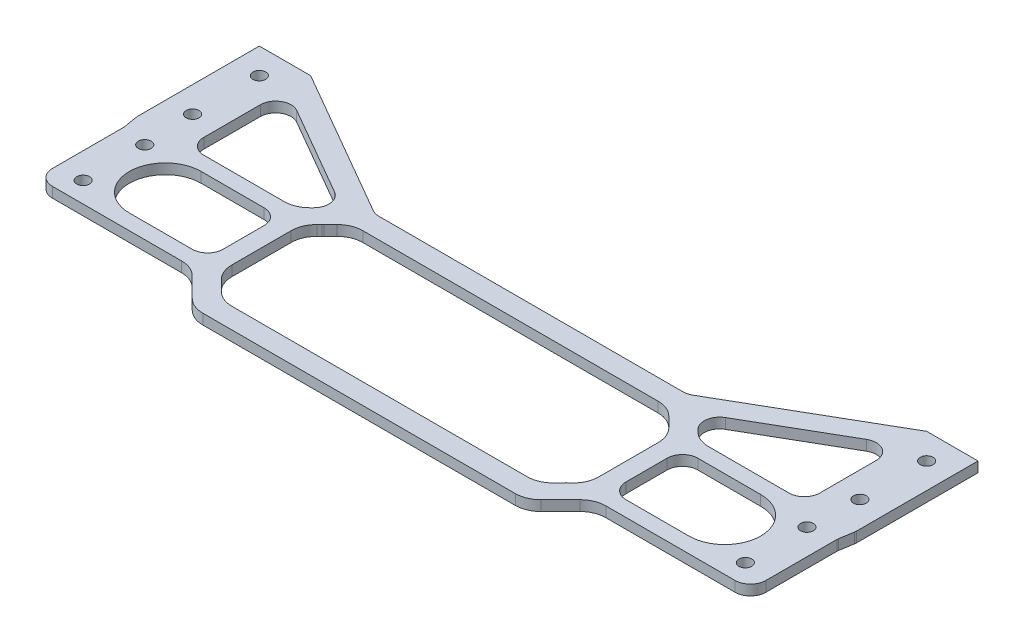
from build123d import *

# Parameters (mm, degrees)
EXTRUDE_1_DEPTH          = 2
HOLE_WIZARD_1_D          = 2.5
CUT_EXTRUDE_1_DEPTH      = 71.244216844
EXTRUDE_2_DEPTH          = 2
CUT_EXTRUDE_2_DEPTH      = 71.244216844
CUT_EXTRUDE_2_DEPTH_BACK = 71.244216844
EXTRUDE_3_DEPTH          = 2
CUT_EXTRUDE_3_DEPTH      = 72.517917335
CUT_EXTRUDE_3_DEPTH_BACK = 72.517917335
EXTRUDE_4_DEPTH          = 2
HOLE_WIZARD_2_D          = 2.5


with BuildPart() as part:
    # 草图1 → 凸台-拉伸1 (new body)
    with BuildSketch(Plane(origin=(0, 0, 0), x_dir=(1, 0, 0), z_dir=(0, 1, 0))):
        with BuildLine():
            Line((66.5, 10), (-66.5, 10))
            ThreePointArc((-66.5, 10), (-68.621320344, 9.121320344), (-69.5, 7))
            Line((-69.5, 7), (-69.5, -7))
            ThreePointArc((-69.5, -7), (-68.621320344, -9.121320344), (-66.5, -10))
            Line((-66.5, -10), (66.5, -10))
            ThreePointArc((66.5, -10), (68.621320344, -9.121320344), (69.5, -7))
            Line((69.5, -7), (69.5, 7))
            ThreePointArc((69.5, 7), (68.621320344, 9.121320344), (66.5, 10))
        make_face()
    extrude(amount=EXTRUDE_1_DEPTH)

    # 孔1 (through all)
    with Locations(Plane(origin=(0, 2, 0), x_dir=(1, 0, 0), z_dir=(0, 1, 0))):
        with Locations((-64.5, 6), (-64.5, -6), (64.5, -6), (64.5, 6)):
            Hole(HOLE_WIZARD_1_D / 2)

    # 草图5 → 切除-拉伸1 (cut, through all)
    with BuildSketch(Plane(origin=(0, 2, 0), x_dir=(1, 0, 0), z_dir=(0, 1, 0))):
        with BuildLine():
            Line((-54.5, 7), (54.5, 7))
            ThreePointArc((54.5, 7), (61.5, 0), (54.5, -7))
            Line((54.5, -7), (-54.5, -7))
            ThreePointArc((-54.5, -7), (-61.5, 0), (-54.5, 7))
        make_face()
    extrude(amount=-CUT_EXTRUDE_1_DEPTH, mode=Mode.SUBTRACT)

    # 草图6 → 凸台-拉伸2 (add)
    with BuildSketch(Plane.XZ):
        with BuildLine():
            Line((-39.249952973, -9.999988019), (39.249952973, -9.999988019))
            Line((39.249952973, -9.999988019), (46.785993788, -7))
            Line((46.785993788, -7), (42.25, -7))
            ThreePointArc((42.25, -7), (40.128679656, -6.121320344), (39.25, -4))
            Line((39.25, -4), (39.25, 4))
            ThreePointArc((39.25, 4), (40.128679656, 6.121320344), (42.25, 7))
            Line((42.25, 7), (46.785993788, 7))
            Line((46.785993788, 7), (39.25, 10))
            Line((39.25, 10), (-39.25, 10))
            Line((-39.25, 10), (-46.786070913, 7))
            Line((-46.786070913, 7), (-42.25, 7))
            ThreePointArc((-42.25, 7), (-40.128679656, 6.121320344), (-39.25, 4))
            Line((-39.25, 4), (-39.25, -4))
            ThreePointArc((-39.25, -4), (-40.128679656, -6.121320344), (-42.25, -7))
            Line((-42.25, -7), (-46.49444439, -7))
            Line((-46.49444439, -7), (-39.249952973, -9.999988019))
        make_face()
    extrude(amount=-EXTRUDE_2_DEPTH)

    # 草图7 → 切除-拉伸2 (cut, two sides: drawn at the far end of the back side and taken through both)
    with BuildSketch(Plane.XZ.offset(-CUT_EXTRUDE_2_DEPTH_BACK)):
        with BuildLine():
            Line((34.25, -1.5), (-34.25, -1.5))
            ThreePointArc((-34.25, -1.5), (-35.75, 0), (-34.25, 1.5))
            Line((-34.25, 1.5), (34.25, 1.5))
            ThreePointArc((34.25, 1.5), (35.75, 0), (34.25, -1.5))
        make_face()
        with BuildLine():
            Line((34.25, 4), (-34.25, 4))
            ThreePointArc((-34.25, 4), (-35.75, 5.5), (-34.25, 7))
            Line((-34.25, 7), (34.25, 7))
            ThreePointArc((34.25, 7), (35.75, 5.5), (34.25, 4))
        make_face()
        with BuildLine():
            Line((34.25, -7), (-34.25, -7))
            ThreePointArc((-34.25, -7), (-35.75, -5.5), (-34.25, -4))
            Line((-34.25, -4), (34.25, -4))
            ThreePointArc((34.25, -4), (35.75, -5.5), (34.25, -7))
        make_face()
    extrude(amount=CUT_EXTRUDE_2_DEPTH + CUT_EXTRUDE_2_DEPTH_BACK, mode=Mode.SUBTRACT)

    # 草图9 → 凸台-拉伸3 (add)
    with BuildSketch(Plane(origin=(0, 0, 0), x_dir=(-1, 0, 0), z_dir=(0, -1, 0))):
        with BuildLine():
            ThreePointArc((37.785533906, -11.464466094), (39.40765065, -10.380602337), (41.321067812, -10))
            Line((41.321067812, -10), (39.25, -10))
            Line((39.25, -10), (33.593145751, -10))
            Line((33.593145751, -10), (32.307611845, -11.285533906))
            ThreePointArc((32.307611845, -11.285533906), (30.6854951, -12.369397663), (28.772077939, -12.75))
            Line((28.772077939, -12.75), (-28.772077939, -12.75))
            ThreePointArc((-28.772077939, -12.75), (-30.6854951, -12.369397663), (-32.307611845, -11.285533906))
            Line((-32.307611845, -11.285533906), (-33.593145751, -10))
            Line((-33.593145751, -10), (-39.25, -10))
            Line((-39.25, -10), (-41.321067812, -10))
            ThreePointArc((-41.321067812, -10), (-39.40765065, -10.380602337), (-37.785533906, -11.464466094))
            Line((-37.785533906, -11.464466094), (-33.964466094, -15.285533906))
            ThreePointArc((-33.964466094, -15.285533906), (-32.34234935, -16.369397663), (-30.428932188, -16.75))
            Line((-30.428932188, -16.75), (30.428932188, -16.75))
            ThreePointArc((30.428932188, -16.75), (32.34234935, -16.369397663), (33.964466094, -15.285533906))
            Line((33.964466094, -15.285533906), (37.785533906, -11.464466094))
        make_face()
        with BuildLine():
            Line((32.307611845, 11.285533906), (33.593145751, 10))
            Line((33.593145751, 10), (39.25, 10))
            Line((39.25, 10), (41.321067812, 10))
            ThreePointArc((41.321067812, 10), (39.40765065, 10.380602337), (37.785533906, 11.464466094))
            Line((37.785533906, 11.464466094), (33.964466094, 15.285533906))
            ThreePointArc((33.964466094, 15.285533906), (32.34234935, 16.369397663), (30.428932188, 16.75))
            Line((30.428932188, 16.75), (-30.428932188, 16.75))
            ThreePointArc((-30.428932188, 16.75), (-32.34234935, 16.369397663), (-33.964466094, 15.285533906))
            Line((-33.964466094, 15.285533906), (-37.785533906, 11.464466094))
            ThreePointArc((-37.785533906, 11.464466094), (-39.40765065, 10.380602337), (-41.321067812, 10))
            Line((-41.321067812, 10), (-39.25, 10))
            Line((-39.25, 10), (-33.593145751, 10))
            Line((-33.593145751, 10), (-32.307611845, 11.285533906))
            ThreePointArc((-32.307611845, 11.285533906), (-30.6854951, 12.369397663), (-28.772077939, 12.75))
            Line((-28.772077939, 12.75), (28.772077939, 12.75))
            ThreePointArc((28.772077939, 12.75), (30.6854951, 12.369397663), (32.307611845, 11.285533906))
        make_face()
    extrude(amount=-EXTRUDE_3_DEPTH)

    # 草图10 → 切除-拉伸3 (cut, two sides: drawn at the far end of the back side and taken through both)
    with BuildSketch(Plane(origin=(0, 2, 0), x_dir=(1, 0, 0), z_dir=(0, 1, 0)).offset(-CUT_EXTRUDE_3_DEPTH_BACK)):
        with BuildLine():
            Line((34.285533906, -9.307611845), (34.098025299, -9.495120452))
            ThreePointArc((34.098025299, -9.495120452), (32.487874075, -10.574009752), (30.588407989, -10.959519378))
            Line((30.588407989, -10.959519378), (-30.221374051, -11.274720124))
            ThreePointArc((-30.221374051, -11.274720124), (-32.148729436, -10.899128383), (-33.782824553, -9.810321198))
            Line((-33.782824553, -9.810321198), (-34.285533906, -9.307611845))
            ThreePointArc((-34.285533906, -9.307611845), (-35.369397663, -7.6854951), (-35.75, -5.772077939))
            Line((-35.75, -5.772077939), (-35.75, 5.772077939))
            ThreePointArc((-35.75, 5.772077939), (-35.369397663, 7.6854951), (-34.285533906, 9.307611845))
            Line((-34.285533906, 9.307611845), (-33.772077939, 9.821067812))
            ThreePointArc((-33.772077939, 9.821067812), (-32.149961195, 10.904931568), (-30.236544033, 11.285533906))
            Line((-30.236544033, 11.285533906), (30.236544033, 11.285533906))
            ThreePointArc((30.236544033, 11.285533906), (32.149961195, 10.904931568), (33.772077939, 9.821067812))
            Line((33.772077939, 9.821067812), (34.285533906, 9.307611845))
            ThreePointArc((34.285533906, 9.307611845), (35.369397663, 7.6854951), (35.75, 5.772077939))
            Line((35.75, 5.772077939), (35.75, -5.772077939))
            ThreePointArc((35.75, -5.772077939), (35.369397663, -7.6854951), (34.285533906, -9.307611845))
        make_face()
    extrude(amount=CUT_EXTRUDE_3_DEPTH + CUT_EXTRUDE_3_DEPTH_BACK, mode=Mode.SUBTRACT)

    # 草图11 → 凸台-拉伸4 (add)
    with BuildSketch(Plane.XZ):
        with BuildLine():
            Line((-70, -10.165525061), (-70, -33.822863961))
            Line((-70, -33.822863961), (-60, -33.822863961))
            Line((-60, -33.822863961), (-31.125084611, -17.151923789))
            ThreePointArc((-31.125084611, -17.151923789), (-30.401541746, -16.852222521), (-29.625084611, -16.75))
            Line((-29.625084611, -16.75), (-21.789130896, -16.75))
            Line((-21.789130896, -16.75), (-32.229816093, -13.630777579))
            Line((-32.229816093, -13.630777579), (-39.940851874, -9.309148126))
            Line((-39.940851874, -9.309148126), (-37.434698294, -11.815301706))
            ThreePointArc((-37.434698294, -11.815301706), (-36.581684053, -14.328200626), (-38.056018637, -16.534698261))
            Line((-38.056018637, -16.534698261), (-55.5, -26.605985597))
            ThreePointArc((-55.5, -26.605985597), (-58.5, -26.605985597), (-60, -24.007909385))
            Line((-60, -24.007909385), (-60, -13))
            ThreePointArc((-60, -13), (-59.121320344, -10.878679656), (-57, -10))
            Line((-57, -10), (-53.184301675, -10))
            Line((-53.184301675, -10), (-53.184301675, -8.509493359))
            Line((-53.184301675, -8.509493359), (-68.301691744, -8.509493359))
            Line((-68.301691744, -8.509493359), (-69.5, -3.184578382))
            Line((-69.5, -3.184578382), (-69.5, -6.834474939))
            ThreePointArc((-69.5, -6.834474939), (-69.506814648, -6.999436002), (-69.527212152, -7.163272914))
            Line((-69.527212152, -7.163272914), (-69.972787848, -9.836727086))
            ThreePointArc((-69.972787848, -9.836727086), (-69.993185352, -10.000563998), (-70, -10.165525061))
        make_face()
        with BuildLine():
            Line((68.301691744, -8.509493359), (69.5, -3.534682622))
            Line((69.5, -3.534682622), (69.5, -6.834474939))
            ThreePointArc((69.5, -6.834474939), (69.506814648, -6.999436002), (69.527212152, -7.163272914))
            Line((69.527212152, -7.163272914), (69.972787848, -9.836727086))
            ThreePointArc((69.972787848, -9.836727086), (69.993185352, -10.000563998), (70, -10.165525061))
            Line((70, -10.165525061), (70, -33.822863961))
            Line((70, -33.822863961), (60, -33.822863961))
            Line((60, -33.822863961), (31.125084611, -17.151923789))
            ThreePointArc((31.125084611, -17.151923789), (30.401541746, -16.852222521), (29.625084611, -16.75))
            Line((29.625084611, -16.75), (21.789130896, -16.75))
            Line((21.789130896, -16.75), (32.229816093, -13.630777579))
            Line((32.229816093, -13.630777579), (39.940851874, -9.309148126))
            Line((39.940851874, -9.309148126), (37.434698294, -11.815301706))
            ThreePointArc((37.434698294, -11.815301706), (36.581684053, -14.328200626), (38.056018637, -16.534698261))
            Line((38.056018637, -16.534698261), (55.5, -26.605985597))
            ThreePointArc((55.5, -26.605985597), (58.5, -26.605985597), (60, -24.007909385))
            Line((60, -24.007909385), (60, -13))
            ThreePointArc((60, -13), (59.121320344, -10.878679656), (57, -10))
            Line((57, -10), (53.184301675, -10))
            Line((53.184301675, -10), (53.184301675, -8.509493359))
            Line((53.184301675, -8.509493359), (68.301691744, -8.509493359))
        make_face()
    extrude(amount=-EXTRUDE_4_DEPTH)

    # 孔2 (through all)
    with Locations(Plane(origin=(0, 0, 0), x_dir=(-1, 0, 0), z_dir=(0, -1, 0))):
        with Locations((65, 15.822863961), (65, 28.822863961), (-65, 15.822863961), (-65, 28.822863961)):
            Hole(HOLE_WIZARD_2_D / 2)


solid = part.part
